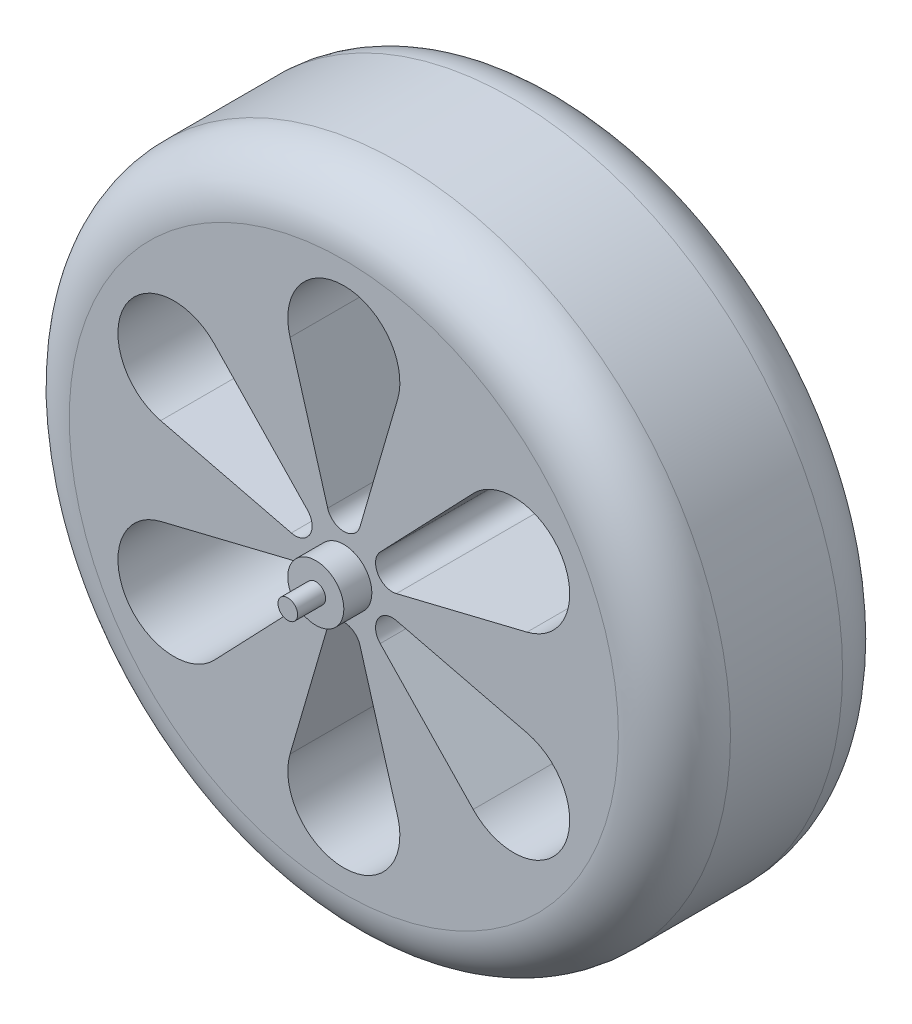
from build123d import *

# Parameters (mm, degrees)
SKETCH_1_R               = 59
EXTRUDE_1_DEPTH          = 40
FILLET_1_R               = 10
SKETCH_2_R               = 5
EXTRUDE_2_DEPTH          = 5
SKETCH_3_R               = 1.75
EXTRUDE_3_DEPTH          = 5
CUT_EXTRUDE_1_DEPTH      = 93.531075925
PATTERN_CIRCULAR_1_COUNT = 6


with BuildPart() as part:
    # 草图1 → 凸台-拉伸1 (new body)
    with BuildSketch(Plane.XY):
        Circle(SKETCH_1_R)
    extrude(amount=EXTRUDE_1_DEPTH)

    # 圆角1
    fillet_1_edges = [part.edges().sort_by_distance(p)[0] for p in [
        (-59, 0, 0),
        (-59, 0, 40),
    ]]
    fillet(fillet_1_edges, radius=FILLET_1_R)

    # 草图2 → 凸台-拉伸2 (add)
    with BuildSketch(Plane.XY.offset(40)):
        Circle(SKETCH_2_R)
    extrude(amount=EXTRUDE_2_DEPTH)

    # 草图3 → 凸台-拉伸3 (add)
    with BuildSketch(Plane.XY.offset(45)):
        Circle(SKETCH_3_R)
    extrude(amount=EXTRUDE_3_DEPTH)

    # 草图4 → 切除-拉伸1 (cut, through all)
    with BuildSketch(Plane.XY.offset(40)):
        with BuildLine():
            Line((-9.6, 32.2), (-2.88, 9.16))
            ThreePointArc((-2.88, 9.16), (0, 7), (2.88, 9.16))
            Line((2.88, 9.16), (9.6, 32.2))
            ThreePointArc((9.6, 32.2), (0, 45), (-9.6, 32.2))
        make_face()
    cut_extrude_1 = extrude(amount=-CUT_EXTRUDE_1_DEPTH, mode=Mode.SUBTRACT)

    # 阵列(圆周)1: 切除-拉伸1 ×6 about axis
    pattern_circular_1_axis = Axis((0, 0, 0), (0, 0, 1))
    for i in range(1, PATTERN_CIRCULAR_1_COUNT):
        add(cut_extrude_1.rotate(pattern_circular_1_axis, i * 360 / PATTERN_CIRCULAR_1_COUNT), mode=Mode.SUBTRACT)


solid = part.part
